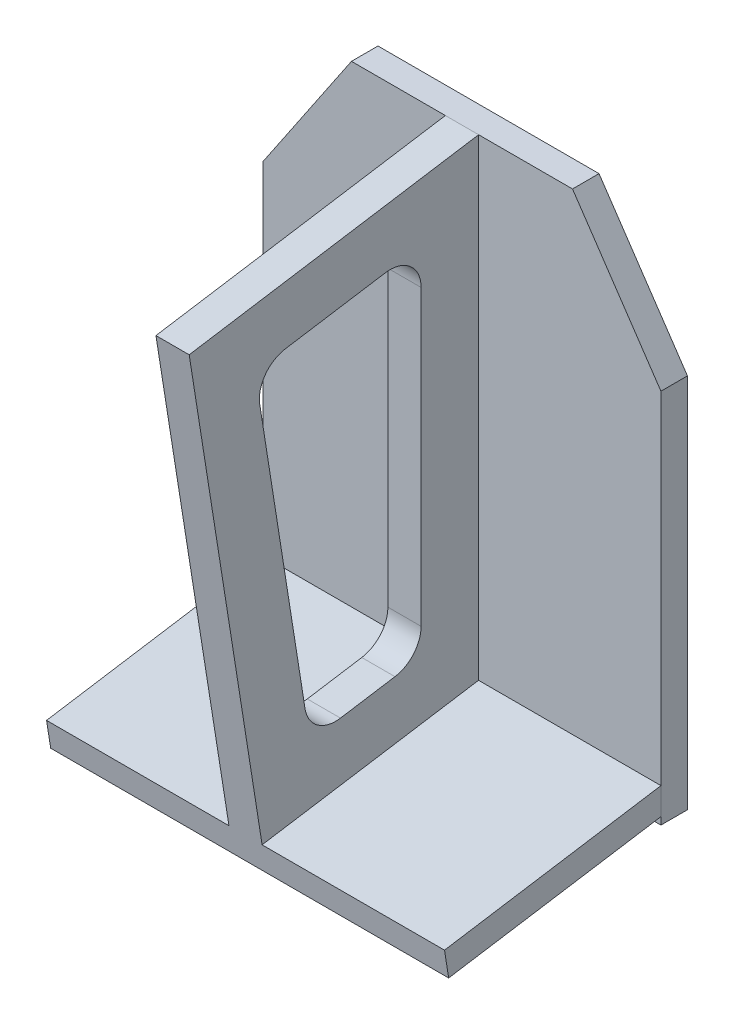
from build123d import *

# Parameters (mm, degrees)
BOSS_EXTRUDE1_DEPTH = 6
BOSS_EXTRUDE3_REACH = 99.376
CUT_EXTRUDE1_DEPTH  = 7.516274167


with BuildPart() as part:
    # Sketch1 → Boss-Extrude1 (new body)
    with BuildSketch(Plane.XY):
        Polygon((-45, -68), (45, -68), (45, 17), (25, 46.620442646), (-25, 46.620442646), (-45, 17), align=None)
    extrude(amount=BOSS_EXTRUDE1_DEPTH)


with BuildPart() as body_2:
    # Boss-Extrude3: up to this plane
    boss_extrude3_end = Plane(origin=(0, 0, 6), z_dir=(0, 0, 1))
    # Sketch2 → Boss-Extrude3 (new, up to the surface)
    with BuildSketch(Plane(origin=(0, -10.155161239, 64.117164656), x_dir=(-1, 0, 0), z_dir=(0, 0.15643446504022426, -0.9876883405951389)), mode=Mode.PRIVATE) as boss_extrude3_sk1:
        Polygon((45.018744933, -64.584267711), (-45, -64.584267711), (-45, -58.584267711), (-3.741030689, -58.584267711), (-3.759259362, 46.984422973), (3.759259418, 46.985074426), (3.759259418, -58.584267711), (45.018744933, -58.584267711), align=None)
    boss_extrude3_tool1 = split(extrude(boss_extrude3_sk1.sketch, amount=BOSS_EXTRUDE3_REACH, mode=Mode.PRIVATE), bisect_by=boss_extrude3_end, keep=Keep.BOTH, mode=Mode.PRIVATE)
    add(boss_extrude3_tool1.solids().sort_by_distance((-0.00651, -38.1979, 59.675631))[0])

    # Sketch3 → Cut-Extrude1 (cut, along a direction that is not the sketch's normal)
    with BuildSketch(Plane.ZY.offset(3.759259418)):
        with BuildLine():
            Line((49.679834781, 26.540189826), (27.095041255, 30.117269708))
            ThreePointArc((27.095041255, 30.117269708), (21.453863662, 28.526293083), (19, 23.203451324))
            Line((19, 23.203451324), (19, -43.18322091))
            ThreePointArc((19, -43.18322091), (20.677158241, -47.729357249), (24.904958745, -50.097039294))
            Line((24.904958745, -50.097039294), (37.23244731, -52.049521672))
            ThreePointArc((37.23244731, -52.049521672), (42.441985332, -50.798822248), (45.24130695, -46.230744543))
            Line((45.24130695, -46.230744543), (55.49861191, 18.531330187))
            ThreePointArc((55.49861191, 18.531330187), (54.247912486, 23.740868208), (49.679834781, 26.540189826))
        make_face()
    extrude(amount=-CUT_EXTRUDE1_DEPTH, dir=(-0.9999999850923286, 0.0001705453289228096, 2.7011726471330954e-05), mode=Mode.SUBTRACT)


solid = Compound([part.part, body_2.part])
